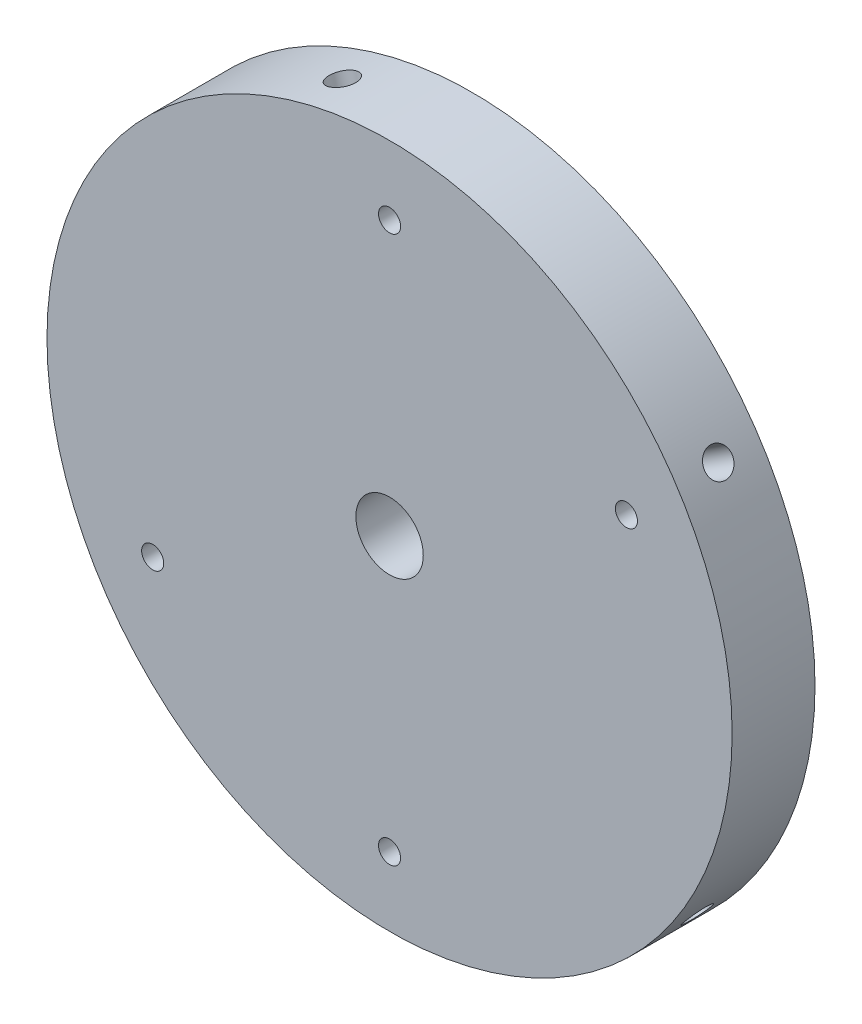
from build123d import *

# Parameters (mm, degrees)
SKETCH1_R                   = 62
BOSS_EXTRUDE1_DEPTH         = 15
SKETCH2_R                   = 2
CUT_EXTRUDE1_DEPTH          = 15
CIRPATTERN1_COUNT           = 2
CIRPATTERN1_ANGLE           = 60
CIRPATTERN2_COUNT           = 2
CIRPATTERN2_COPY_1_SKETCH_R = 2
CIRPATTERN2_COPY_1_DEPTH    = 15
SKETCH3_R                   = 6.1
CUT_EXTRUDE2_DEPTH          = 15
SKETCH4_R                   = 2.5
CUT_EXTRUDE4_DEPTH          = 10
CIRPATTERN5_COUNT           = 5


with BuildPart() as part:
    # Sketch1 → Boss-Extrude1 (new body)
    with BuildSketch(Plane.XY):
        Circle(SKETCH1_R)
    extrude(amount=BOSS_EXTRUDE1_DEPTH)

    # Sketch2 → Cut-Extrude1 (cut)
    with BuildSketch(Plane.XY.offset(15)):
        with Locations((0, 49.5)):
            Circle(SKETCH2_R)
    cut_extrude1 = extrude(amount=-CUT_EXTRUDE1_DEPTH, mode=Mode.SUBTRACT)

    # CirPattern1: Cut-Extrude1 ×2 about axis
    cirpattern1_axis = Axis((0, 0, 15), (0, 0, -1))
    for i in range(1, CIRPATTERN1_COUNT):
        add(cut_extrude1.rotate(cirpattern1_axis, i * CIRPATTERN1_ANGLE / (CIRPATTERN1_COUNT - 1)), mode=Mode.SUBTRACT)

    # CirPattern2: Cut-Extrude1 ×2 about axis
    cirpattern2_axis = Axis((0, 0, 15), (0, 0, -1))
    for i in range(1, CIRPATTERN2_COUNT):
        add(cut_extrude1.rotate(cirpattern2_axis, i * 360 / CIRPATTERN2_COUNT), mode=Mode.SUBTRACT)

    # CirPattern2 copy 1 sketch → CirPattern2 copy 1 (cut)
    with BuildSketch(Plane(origin=(0, 0, 15), x_dir=(-0.4999999999999979, 0.8660254037844398, 0), z_dir=(0, 0, 1))):
        with Locations((0, 49.5)):
            Circle(CIRPATTERN2_COPY_1_SKETCH_R)
    extrude(amount=-CIRPATTERN2_COPY_1_DEPTH, mode=Mode.SUBTRACT)

    # Sketch3 → Cut-Extrude2 (cut)
    with BuildSketch(Plane.XY.offset(15)):
        Circle(SKETCH3_R)
    extrude(amount=-CUT_EXTRUDE2_DEPTH, mode=Mode.SUBTRACT)

    # Sketch4 → Cut-Extrude4 (cut)
    with BuildSketch(Plane(origin=(51.997575213, 33.767620171, 0), x_dir=(0, 0, -1), z_dir=(-0.8386705679454236, -0.544639035015028, 0))):
        with Locations((-7.5, 0)):
            Circle(SKETCH4_R)
    cut_extrude4 = extrude(amount=CUT_EXTRUDE4_DEPTH, mode=Mode.SUBTRACT)

    # CirPattern5: Cut-Extrude4 ×5 about axis
    cirpattern5_axis = Axis((0, 0, 0), (0, 0, 1))
    for i in range(1, CIRPATTERN5_COUNT):
        add(cut_extrude4.rotate(cirpattern5_axis, i * 360 / CIRPATTERN5_COUNT), mode=Mode.SUBTRACT)


solid = part.part
